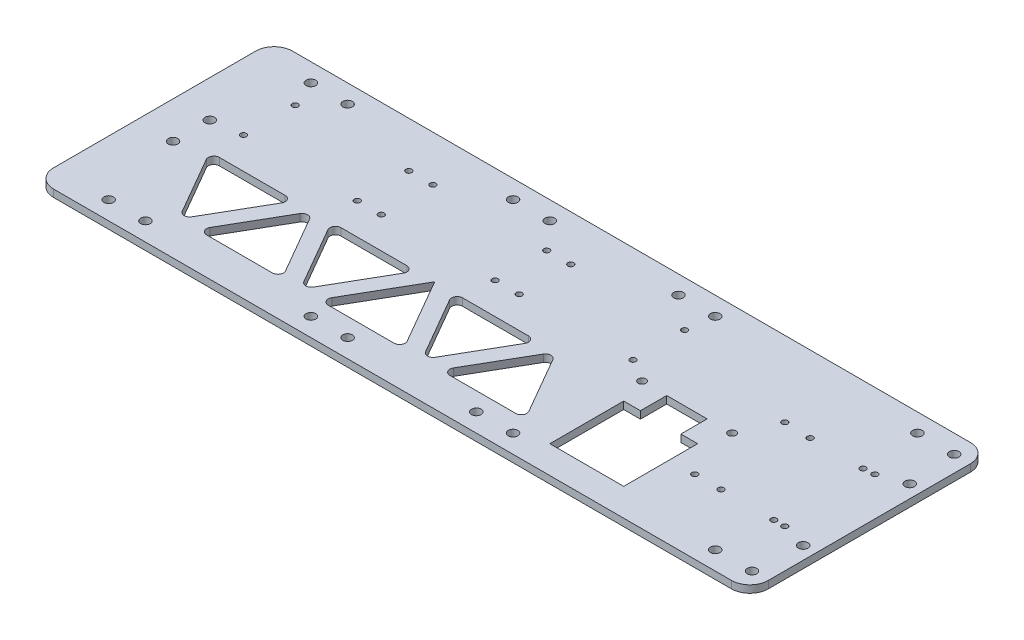
from build123d import *

# Parameters (mm, degrees)
SKETCH_1_W          = 388.85
SKETCH_1_H          = 130
EXTRUDE_1_DEPTH     = 4
SKETCH_2_R          = 1.6
CUT_EXTRUDE_1_DEPTH = 4
SKETCH_3_R          = 2.6
CUT_EXTRUDE_2_DEPTH = 411.024782788
SKETCH_5_R          = 2.6
CUT_EXTRUDE_3_DEPTH = 411.024782788
SKETCH_7_R          = 2.1
CUT_EXTRUDE_5_DEPTH = 411.024782788
SKETCH_8_R          = 1.6
CUT_EXTRUDE_6_DEPTH = 411.024782788
SKETCH_9_R          = 1.6
CUT_EXTRUDE_7_DEPTH = 411.024782788
SKETCH_10_R         = 2.6
CUT_EXTRUDE_8_DEPTH = 411.024782788
FILLET_1_R          = 10
CUT_EXTRUDE_9_DEPTH = 411.024782788
FILLET_2_R          = 3


with BuildPart() as part:
    # 草图1 → 凸台-拉伸1 (new body)
    with BuildSketch(Plane(origin=(0, 0, 0), x_dir=(1, 0, 0), z_dir=(0, 1, 0))):
        with Locations((194.425, -65)):
            Rectangle(SKETCH_1_W, SKETCH_1_H)
    extrude(amount=EXTRUDE_1_DEPTH)

    # 草图2 → 切除-拉伸1 (cut)
    with BuildSketch(Plane(origin=(0, 4, 0), x_dir=(1, 0, 0), z_dir=(0, 1, 0))):
        with Locations(Location((36.21, -52.9, 0), (0, 0, 270))):
            Circle(SKETCH_2_R)
        with Locations(Location((98.11, -52.9, 0), (0, 0, 270))):
            Circle(SKETCH_2_R)
        with Locations(Location((98.11, -24.8, 0), (0, 0, 270))):
            Circle(SKETCH_2_R)
        with Locations(Location((111.21, -24.8, 0), (0, 0, 270))):
            Circle(SKETCH_2_R)
        with Locations(Location((111.21, -52.9, 0), (0, 0, 270))):
            Circle(SKETCH_2_R)
        with Locations(Location((173.11, -24.8, 0), (0, 0, 270))):
            Circle(SKETCH_2_R)
        with Locations(Location((173.11, -52.9, 0), (0, 0, 270))):
            Circle(SKETCH_2_R)
        with Locations(Location((186.21, -24.8, 0), (0, 0, 270))):
            Circle(SKETCH_2_R)
        with Locations(Location((186.21, -52.9, 0), (0, 0, 270))):
            Circle(SKETCH_2_R)
        with Locations(Location((248.11, -52.9, 0), (0, 0, 270))):
            Circle(SKETCH_2_R)
        with Locations(Location((36.21, -24.8, 0), (0, 0, 270))):
            Circle(SKETCH_2_R)
        with Locations(Location((248.11, -24.8, 0), (0, 0, 270))):
            Circle(SKETCH_2_R)
    extrude(amount=-CUT_EXTRUDE_1_DEPTH, mode=Mode.SUBTRACT)

    # 草图3 → 切除-拉伸2 (cut, through all)
    with BuildSketch(Plane(origin=(0, 4, 0), x_dir=(1, 0, 0), z_dir=(0, 1, 0))):
        with Locations(Location((20, -75, 0), (0, 0, 270))):
            Circle(SKETCH_3_R)
        with Locations(Location((20, -55, 0), (0, 0, 270))):
            Circle(SKETCH_3_R)
    extrude(amount=-CUT_EXTRUDE_2_DEPTH, mode=Mode.SUBTRACT)

    # 草图5 → 切除-拉伸3 (cut, through all)
    with BuildSketch(Plane(origin=(0, 4, 0), x_dir=(1, 0, 0), z_dir=(0, 1, 0))):
        with Locations(Location((30, -10, 0), (0, 0, 270))):
            Circle(SKETCH_5_R)
        with Locations(Location((50, -10, 0), (0, 0, 270))):
            Circle(SKETCH_5_R)
        with Locations(Location((140, -10, 0), (0, 0, 270))):
            Circle(SKETCH_5_R)
        with Locations(Location((160, -10, 0), (0, 0, 270))):
            Circle(SKETCH_5_R)
        with Locations(Location((230, -10, 0), (0, 0, 270))):
            Circle(SKETCH_5_R)
        with Locations(Location((250, -10, 0), (0, 0, 270))):
            Circle(SKETCH_5_R)
        with Locations(Location((360, -10, 0), (0, 0, 270))):
            Circle(SKETCH_5_R)
        with Locations(Location((380, -10, 0), (0, 0, 270))):
            Circle(SKETCH_5_R)
        with Locations(Location((380, -120, 0), (0, 0, 90))):
            Circle(SKETCH_5_R)
        with Locations(Location((360, -120, 0), (0, 0, 90))):
            Circle(SKETCH_5_R)
        with Locations(Location((250, -120, 0), (0, 0, 90))):
            Circle(SKETCH_5_R)
        with Locations(Location((230, -120, 0), (0, 0, 90))):
            Circle(SKETCH_5_R)
        with Locations(Location((160, -120, 0), (0, 0, 90))):
            Circle(SKETCH_5_R)
        with Locations(Location((140, -120, 0), (0, 0, 90))):
            Circle(SKETCH_5_R)
        with Locations(Location((50, -120, 0), (0, 0, 90))):
            Circle(SKETCH_5_R)
        with Locations(Location((30, -120, 0), (0, 0, 90))):
            Circle(SKETCH_5_R)
    extrude(amount=-CUT_EXTRUDE_3_DEPTH, mode=Mode.SUBTRACT)

    # 草图7 → 切除-拉伸5 (cut, through all)
    with BuildSketch(Plane(origin=(0, 4, 0), x_dir=(1, 0, 0), z_dir=(0, 1, 0))):
        with Locations(Location((260.6, -60.4, 0), (0, 0, 270))):
            Circle(SKETCH_7_R)
        with Locations(Location((309.6, -60.4, 0), (0, 0, 90))):
            Circle(SKETCH_7_R)
        Polygon((305.2, -74.8), (305.2, -115), (265, -115), (265, -74.8), (274.1, -74.8), (274.1, -60.5), (296.1, -60.5), (296.1, -74.8), align=None)
    extrude(amount=-CUT_EXTRUDE_5_DEPTH, mode=Mode.SUBTRACT)

    # 草图8 → 切除-拉伸6 (cut, through all)
    with BuildSketch(Plane(origin=(0, 4, 0), x_dir=(1, 0, 0), z_dir=(0, 1, 0))):
        with Locations(Location((318.85, -41, 0), (0, 0, 270))):
            Circle(SKETCH_8_R)
        with Locations(Location((367.85, -41, 0), (0, 0, 270))):
            Circle(SKETCH_8_R)
        with Locations(Location((318.85, -90, 0), (0, 0, 270))):
            Circle(SKETCH_8_R)
        with Locations(Location((367.85, -90, 0), (0, 0, 270))):
            Circle(SKETCH_8_R)
    extrude(amount=-CUT_EXTRUDE_6_DEPTH, mode=Mode.SUBTRACT)

    # 草图9 → 切除-拉伸7 (cut, through all)
    with BuildSketch(Plane(origin=(0, 4, 0), x_dir=(1, 0, 0), z_dir=(0, 1, 0))):
        with Locations(Location((333.15, -41.5, 0), (0, 0, 270))):
            Circle(SKETCH_9_R)
        with Locations(Location((361.85, -41.5, 0), (0, 0, 270))):
            Circle(SKETCH_9_R)
        with Locations(Location((333.15, -90, 0), (0, 0, 270))):
            Circle(SKETCH_9_R)
        with Locations(Location((361.85, -90, 0), (0, 0, 270))):
            Circle(SKETCH_9_R)
    extrude(amount=-CUT_EXTRUDE_7_DEPTH, mode=Mode.SUBTRACT)

    # 草图10 → 切除-拉伸8 (cut, through all)
    with BuildSketch(Plane(origin=(0, 4, 0), x_dir=(1, 0, 0), z_dir=(0, 1, 0))):
        with Locations(Location((381.85, -36, 0), (0, 0, 270))):
            Circle(SKETCH_10_R)
        with Locations(Location((381.85, -94, 0), (0, 0, 90))):
            Circle(SKETCH_10_R)
    extrude(amount=-CUT_EXTRUDE_8_DEPTH, mode=Mode.SUBTRACT)

    # 圆角1
    fillet_1_edges = [part.edges().sort_by_distance(p)[0] for p in [
        (0, 2, 0),
        (388.85, 2, 0),
        (388.85, 2, 130),
        (0, 2, 130),
    ]]
    fillet(fillet_1_edges, radius=FILLET_1_R)

    # 草图11 → 切除-拉伸9 (cut, through all)
    with BuildSketch(Plane(origin=(0, 4, 0), x_dir=(1, 0, 0), z_dir=(0, 1, 0))):
        Polygon((58.095, -110.001713401), (81.19, -70), (35, -70), align=None)
        Polygon((68.095, -110.001713401), (114.285, -110.001713401), (91.19, -70), align=None)
        Polygon((124.285, -110.001713401), (147.38, -70), (101.19, -70), align=None)
        Polygon((134.285, -110.001713401), (180.475, -110.001713401), (157.38, -70), align=None)
        Polygon((190.475, -110.001713401), (213.57, -70), (167.38, -70), align=None)
        Polygon((200.475, -110.001713401), (246.665, -110.001713401), (223.57, -70), align=None)
    extrude(amount=-CUT_EXTRUDE_9_DEPTH, mode=Mode.SUBTRACT)

    # 圆角2
    fillet_2_edges = [part.edges().sort_by_distance(p)[0] for p in [
        (134.285, 2, 110.001713401),
        (180.475, 2, 110.001713401),
        (190.475, 2, 110.001713401),
        (167.38, 2, 70),
        (213.57, 2, 70),
        (68.095, 2, 110.001713401),
        (91.19, 2, 70),
        (114.285, 2, 110.001713401),
        (124.285, 2, 110.001713401),
        (101.19, 2, 70),
        (147.38, 2, 70),
        (200.475, 2, 110.001713401),
        (223.57, 2, 70),
        (246.665, 2, 110.001713401),
        (58.095, 2, 110.001713401),
        (35, 2, 70),
        (81.19, 2, 70),
    ]]
    fillet(fillet_2_edges, radius=FILLET_2_R)


solid = part.part
